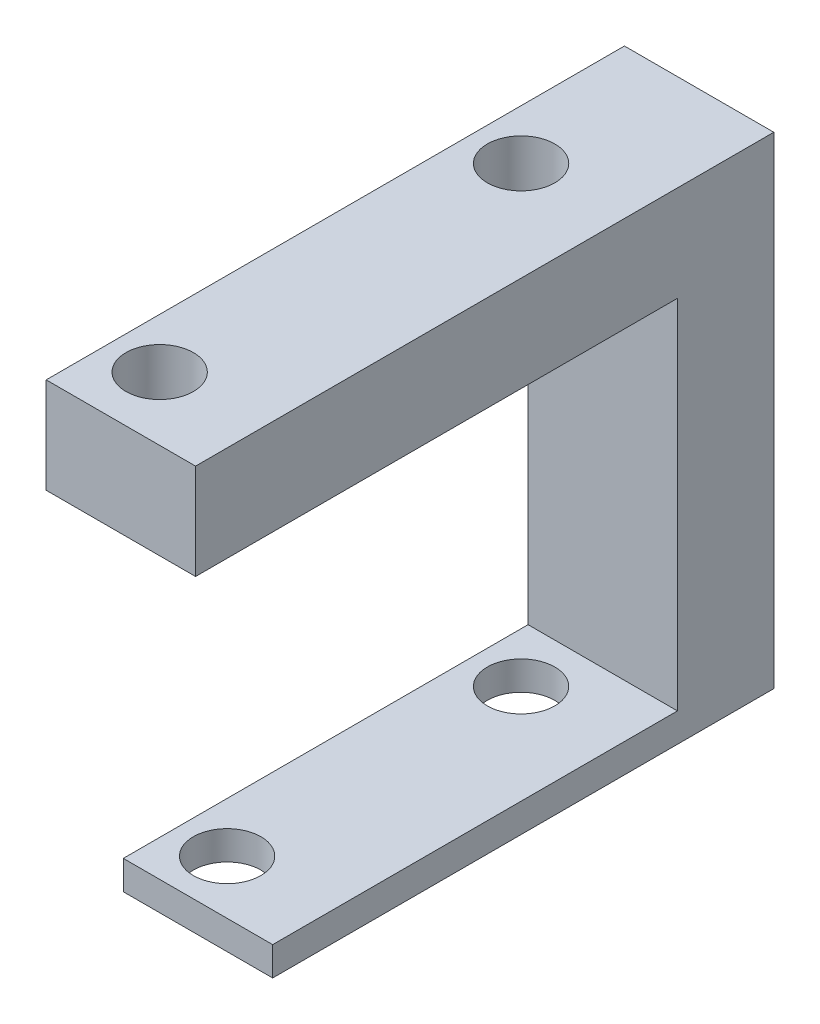
from build123d import *

# Parameters (mm, degrees)
BOSS_EXTRUDE1_DEPTH = 7.874
SKETCH4_R           = 1.778
CUT_EXTRUDE2_DEPTH  = 20.828
CUT_EXTRUDE3_START  = -6.35
SKETCH5_R           = 1.778
CUT_EXTRUDE3_DEPTH  = 6.35


with BuildPart() as part:
    # Sketch1 → Boss-Extrude1 (new body)
    with BuildSketch(Plane(origin=(0, 0, 0), x_dir=(0, 0, -1), z_dir=(1, 0, 0))):
        Polygon((-10.547521943, 32.599346848), (-10.547521943, 7.199346848), (-36.963521943, 7.199346848), (-36.963521943, 8.723346848), (-15.627521943, 8.723346848), (-15.627521943, 27.558210738), (-41.027521943, 27.558210738), (-41.027521943, 32.599346848), align=None)
    extrude(amount=-BOSS_EXTRUDE1_DEPTH)

    # Sketch4 → Cut-Extrude2 (cut)
    with BuildSketch(Plane(origin=(0, 0, 0), x_dir=(1, 0, 0), z_dir=(0, 1, 0))):
        with Locations(Location((-5.23875, -18.631071943, 0), (0, 0, 90))):
            Circle(SKETCH4_R)
        with Locations(Location((-5.23875, -34.125071943, 0), (0, 0, 90))):
            Circle(SKETCH4_R)
    extrude(amount=CUT_EXTRUDE2_DEPTH, mode=Mode.SUBTRACT)

    # Sketch5 → Cut-Extrude3 (cut)
    with BuildSketch(Plane(origin=(0, 32.599346848, 0), x_dir=(1, 0, 0), z_dir=(0, 1, 0)).offset(CUT_EXTRUDE3_START)):
        with Locations(Location((-5.23875, -18.631071943, 0), (0, 0, 90))):
            Circle(SKETCH5_R)
        with Locations(Location((-5.23875, -37.681071943, 0), (0, 0, 270))):
            Circle(SKETCH5_R)
    extrude(amount=CUT_EXTRUDE3_DEPTH, mode=Mode.SUBTRACT)


solid = part.part
